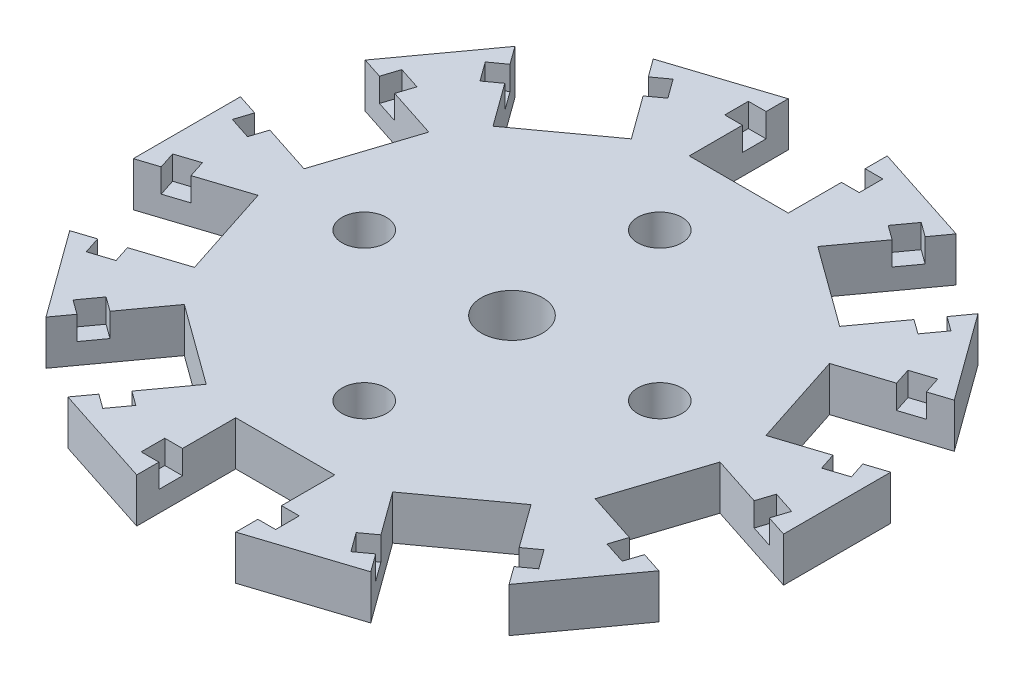
from build123d import *

# Parameters (mm, degrees)
BOSS_EXTRUDE1_DEPTH = 3
CUT_EXTRUDE1_DEPTH  = 3
SKETCH7_R           = 1.5
CUT_EXTRUDE3_DEPTH  = 3
SKETCH10_R          = 2.075
CUT_EXTRUDE6_DEPTH  = 3
SKETCH4_W           = 9.1
SKETCH4_H           = 1.6
CUT_EXTRUDE2_DEPTH  = 1.6


with BuildPart() as part:
    # Sketch1 → Boss-Extrude1 (new body)
    with BuildSketch(Plane(origin=(0, 0, 0), x_dir=(1, 0, 0), z_dir=(0, 1, 0))):
        Polygon((0, 23.132168933), (-13.596747752, 18.714317784), (-22, 7.148233317), (-22, -7.148233317), (-13.596747752, -18.714317784), (0, -23.132168933), (13.596747752, -18.714317784), (22, -7.148233317), (22, 7.148233317), (13.596747752, 18.714317784), align=None)
    extrude(amount=BOSS_EXTRUDE1_DEPTH)

    # Sketch2 → Cut-Extrude1 (cut)
    with BuildSketch(Plane(origin=(0, 3, 0), x_dir=(1, 0, 0), z_dir=(0, 1, 0))):
        Polygon((0, 23.132168933), (-3.35, 22.043687951), (-3.35, 15.343687951), (3.35, 15.343687951), (3.35, 22.043687951), align=None)
        Polygon((11.729000424, 10.444223713), (15.667161615, 15.864637576), (13.596747752, 18.714317784), (10.246747752, 19.802798766), (6.308586562, 14.382384904), align=None)
        Polygon((15.627921341, 1.555421004), (22, 3.625834866), (22, 7.148233317), (19.929586138, 9.997913525), (13.557507479, 7.927499663), align=None)
        Polygon((13.557507479, -7.927499663), (19.929586138, -9.997913525), (22, -7.148233317), (22, -3.625834866), (15.627921341, -1.555421004), align=None)
        Polygon((6.308586562, -14.382384904), (10.246747752, -19.802798766), (13.596747752, -18.714317784), (15.667161615, -15.864637576), (11.729000424, -10.444223713), align=None)
        Polygon((-3.35, -15.343687951), (-3.35, -22.043687951), (0, -23.132168933), (3.35, -22.043687951), (3.35, -15.343687951), align=None)
        Polygon((-11.729000424, -10.444223713), (-15.667161615, -15.864637576), (-13.596747752, -18.714317784), (-10.246747752, -19.802798766), (-6.308586562, -14.382384904), align=None)
        Polygon((-15.627921341, -1.555421004), (-22, -3.625834866), (-22, -7.148233317), (-19.929586138, -9.997913525), (-13.557507479, -7.927499663), align=None)
        Polygon((-13.557507479, 7.927499663), (-19.929586138, 9.997913525), (-22, 7.148233317), (-22, 3.625834866), (-15.627921341, 1.555421004), align=None)
        Polygon((-6.308586562, 14.382384904), (-10.246747752, 19.802798766), (-13.596747752, 18.714317784), (-15.667161615, 15.864637576), (-11.729000424, 10.444223713), align=None)
    extrude(amount=-CUT_EXTRUDE1_DEPTH, mode=Mode.SUBTRACT)

    # Sketch7 → Cut-Extrude3 (cut)
    with BuildSketch(Plane(origin=(0, 3, 0), x_dir=(1, 0, 0), z_dir=(0, 1, 0))):
        with Locations(Location((0, 10, 0), (0, 0, 270))):
            Circle(SKETCH7_R)
        with Locations(Location((10, 0, 0), (0, 0, 270))):
            Circle(SKETCH7_R)
        with Locations(Location((0, -10, 0), (0, 0, 270))):
            Circle(SKETCH7_R)
        with Locations(Location((-10, 0, 0), (0, 0, 270))):
            Circle(SKETCH7_R)
    extrude(amount=-CUT_EXTRUDE3_DEPTH, mode=Mode.SUBTRACT)

    # Sketch10 → Cut-Extrude6 (cut)
    with BuildSketch(Plane(origin=(0, 3, 0), x_dir=(1, 0, 0), z_dir=(0, 1, 0))):
        with Locations(Location((0, 0, 0), (0, 0, 270))):
            Circle(SKETCH10_R)
    extrude(amount=-CUT_EXTRUDE6_DEPTH, mode=Mode.SUBTRACT)

    # Sketch4 → Cut-Extrude2 (cut)
    with BuildSketch(Plane(origin=(0, 3, 0), x_dir=(1, 0, 0), z_dir=(0, 1, 0))):
        with Locations((0, 19.743687951)):
            Rectangle(SKETCH4_W, SKETCH4_H)
        Polygon((7.453793077, 18.000188386), (8.394249481, 19.294615577), (15.75630413, 13.945769781), (14.815847726, 12.65134259), align=None)
        Polygon((16.610490544, 10.181228662), (18.13218097, 10.675655853), (20.944235619, 2.021041555), (19.422545193, 1.526614364), align=None)
        Polygon((19.422545193, -1.526614364), (20.944235619, -2.021041555), (18.13218097, -10.675655853), (16.610490544, -10.181228662), align=None)
        Polygon((14.815847726, -12.65134259), (15.75630413, -13.945769781), (8.394249481, -19.294615577), (7.453793077, -18.000188386), align=None)
        with Locations((0, -19.743687951)):
            Rectangle(SKETCH4_W, SKETCH4_H)
        Polygon((-7.453793077, -18.000188386), (-8.394249481, -19.294615577), (-15.75630413, -13.945769781), (-14.815847726, -12.65134259), align=None)
        Polygon((-16.610490544, -10.181228662), (-18.13218097, -10.675655853), (-20.944235619, -2.021041555), (-19.422545193, -1.526614364), align=None)
        Polygon((-19.422545193, 1.526614364), (-20.944235619, 2.021041555), (-18.13218097, 10.675655853), (-16.610490544, 10.181228662), align=None)
        Polygon((-14.815847726, 12.65134259), (-15.75630413, 13.945769781), (-8.394249481, 19.294615577), (-7.453793077, 18.000188386), align=None)
    extrude(amount=-CUT_EXTRUDE2_DEPTH, mode=Mode.SUBTRACT)


solid = part.part
